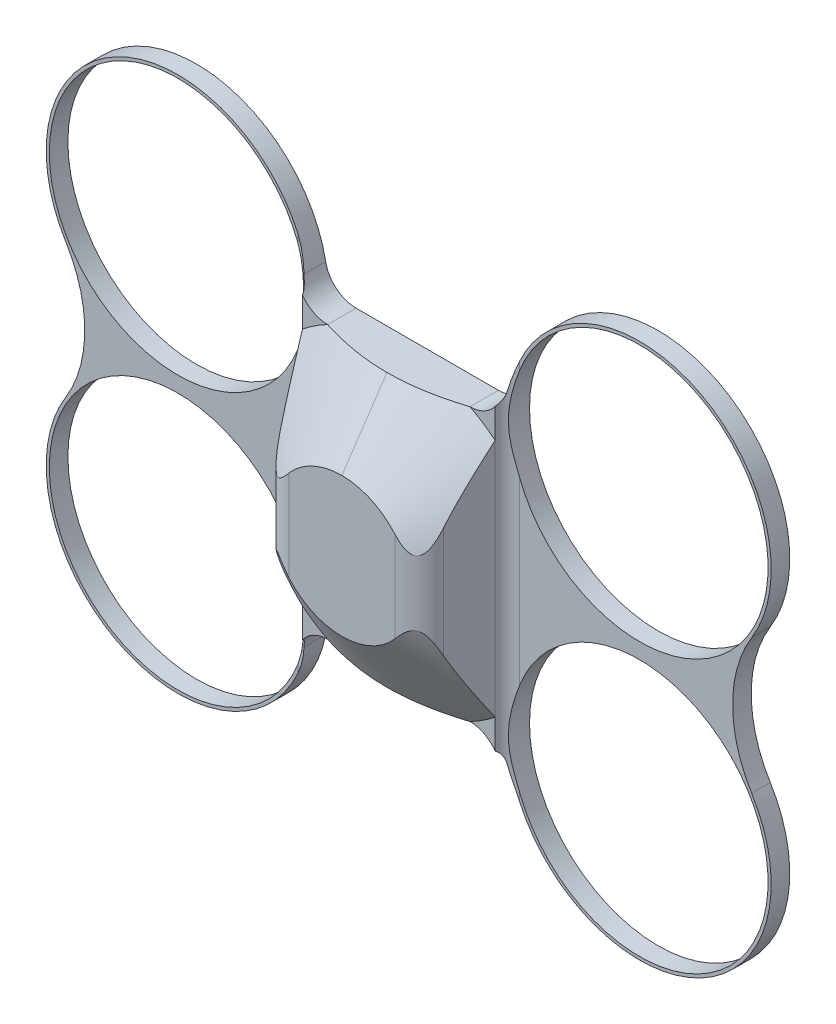
from build123d import *

# Parameters (mm, degrees)
BOSS_EXTRUDE1_DEPTH     = 27.56
CUT_EXTRUDE1_DEPTH      = 149.090525018
CUT_EXTRUDE1_DEPTH_BACK = 149.090525018
CUT_EXTRUDE2_DEPTH      = 149.090525174
CUT_EXTRUDE2_DEPTH_BACK = 149.090525174
SKETCH3_R               = 41.5


with BuildPart() as part:
    # Sketch1 → Boss-Extrude1 (new body)
    with BuildSketch(Plane.XY):
        with BuildLine():
            Line((22.96117968, 44), (-22.96117968, 44))
            ThreePointArc((-22.96117968, 44), (-29.323269783, 46.284832502), (-32.778097836, 52.095238095))
            ThreePointArc((-32.778097836, 52.095238095), (-89.927364847, 83.601091069), (-110.70300535, 21.738095238))
            ThreePointArc((-110.70300535, 21.738095238), (-104.55417528, 0), (-110.70300535, -21.738095238))
            ThreePointArc((-110.70300535, -21.738095238), (-89.927364847, -83.601091069), (-32.778097836, -52.095238095))
            ThreePointArc((-32.778097836, -52.095238095), (-29.323269783, -46.284832502), (-22.96117968, -44))
            Line((-22.96117968, -44), (22.96117968, -44))
            ThreePointArc((22.96117968, -44), (29.323269783, -46.284832502), (32.778097836, -52.095238095))
            ThreePointArc((32.778097836, -52.095238095), (89.927364847, -83.601091069), (110.70300535, -21.738095238))
            ThreePointArc((110.70300535, -21.738095238), (104.55417528, 0), (110.70300535, 21.738095238))
            ThreePointArc((110.70300535, 21.738095238), (89.927364847, 83.601091069), (32.778097836, 52.095238095))
            ThreePointArc((32.778097836, 52.095238095), (29.323269783, 46.284832502), (22.96117968, 44))
        make_face()
    extrude(amount=BOSS_EXTRUDE1_DEPTH)

    # Sketch2 → Cut-Extrude1 (cut, two sides: drawn at the far end of the back side and taken through both)
    with BuildSketch(Plane(origin=(0, 0, 0), x_dir=(1, 0, 0), z_dir=(0, 1, 0)).offset(-CUT_EXTRUDE1_DEPTH_BACK)):
        with BuildLine():
            Line((117, -6), (35.767564174, -6))
            ThreePointArc((35.767564174, -6), (32.945610035, -6.872461407), (31.108474327, -9.185370066))
            Line((31.108474327, -9.185370066), (26.433179694, -21.189259868))
            ThreePointArc((26.433179694, -21.189259868), (22.758908279, -25.815077185), (17.115, -27.56))
            Line((17.115, -27.56), (117, -27.56))
            Line((117, -27.56), (117, -6))
        make_face()
        with BuildLine():
            Line((-117, -27.56), (-117, -6))
            Line((-117, -6), (-35.767564174, -6))
            ThreePointArc((-35.767564174, -6), (-32.945610035, -6.872461407), (-31.108474327, -9.185370066))
            Line((-31.108474327, -9.185370066), (-26.433179694, -21.189259868))
            ThreePointArc((-26.433179694, -21.189259868), (-22.758908279, -25.815077185), (-17.115, -27.56))
            Line((-17.115, -27.56), (-117, -27.56))
        make_face()
    extrude(amount=CUT_EXTRUDE1_DEPTH + CUT_EXTRUDE1_DEPTH_BACK, mode=Mode.SUBTRACT)

    # Sketch3 → Cut-Extrude2 (cut, two sides: drawn at the far end of the back side and taken through both)
    with BuildSketch(Plane(origin=(0, 0, 0), x_dir=(-1, 0, 0), z_dir=(0, 0, -1)).offset(-CUT_EXTRUDE2_DEPTH_BACK)):
        with Locations((-74.5, 44)):
            Circle(SKETCH3_R)
        with Locations((-74.5, -44)):
            Circle(SKETCH3_R)
        with Locations((74.5, 44)):
            Circle(SKETCH3_R)
        with Locations((74.5, -44)):
            Circle(SKETCH3_R)
    extrude(amount=CUT_EXTRUDE2_DEPTH + CUT_EXTRUDE2_DEPTH_BACK, mode=Mode.SUBTRACT)

    # Cut-Sweep1: sweep along a path in Sketch4
    with BuildLine(Plane.XY.offset(27.56)) as cut_sweep1_path:
        CenterArc((0, 0), 22.5, 0, 360)
    # Sketch5 → Cut-Sweep1 (sweep, cut)
    with BuildSketch(Plane(origin=(0, 0, 0), x_dir=(0, 0, -1), z_dir=(1, 0, 0))):
        Polygon((-27.56, 22.5), (-9.185370066, 49.639215001), (-9.185370066, 86.5), (-27.56, 86.5), (-27.56, 48.201587292), align=None)
    sweep(path=cut_sweep1_path.line, mode=Mode.SUBTRACT)


solid = part.part
